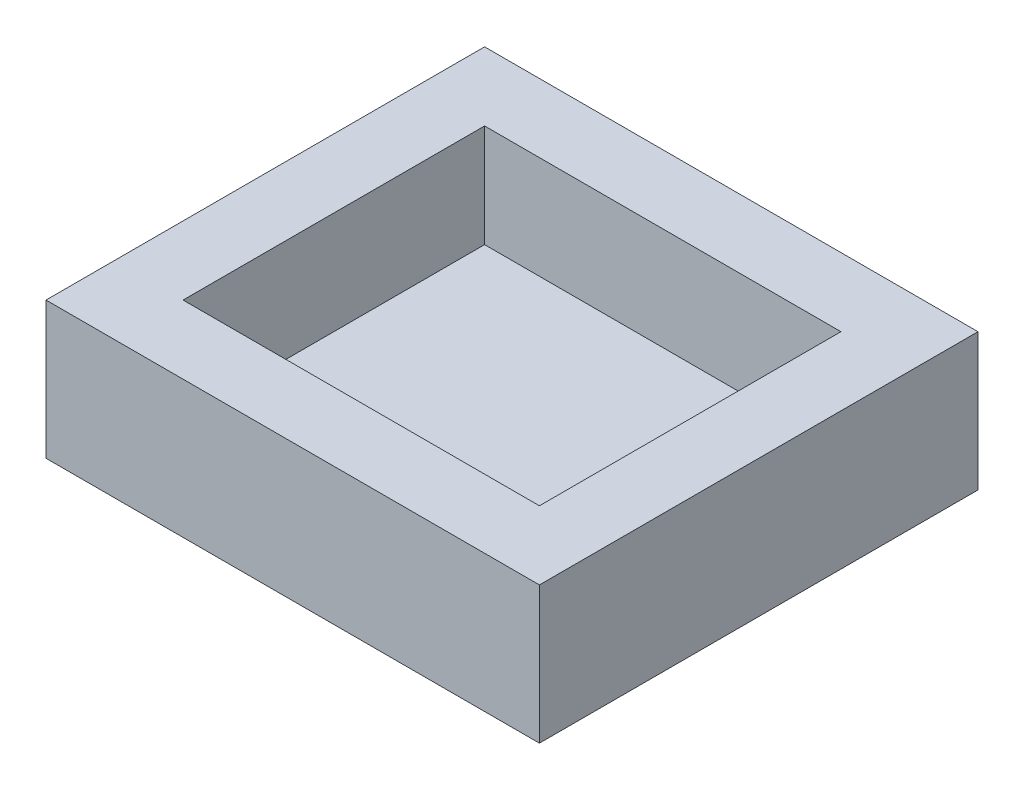
from build123d import *

# Parameters (mm, degrees)
SKETCH2_W           = 45.72
SKETCH2_H           = 40.64
BOSS_EXTRUDE1_DEPTH = 12.7
SKETCH3_W           = 33.02
SKETCH3_H           = 27.94
CUT_EXTRUDE1_DEPTH  = 9.525


with BuildPart() as part:
    # Sketch2 → Boss-Extrude1 (new body)
    with BuildSketch(Plane(origin=(0, 0, 0), x_dir=(1, 0, 0), z_dir=(0, 1, 0))):
        Rectangle(SKETCH2_W, SKETCH2_H)
    extrude(amount=BOSS_EXTRUDE1_DEPTH)

    # Sketch3 → Cut-Extrude1 (cut)
    with BuildSketch(Plane(origin=(0, 12.7, 0), x_dir=(1, 0, 0), z_dir=(0, 1, 0))):
        Rectangle(SKETCH3_W, SKETCH3_H)
    extrude(amount=-CUT_EXTRUDE1_DEPTH, mode=Mode.SUBTRACT)


solid = part.part
